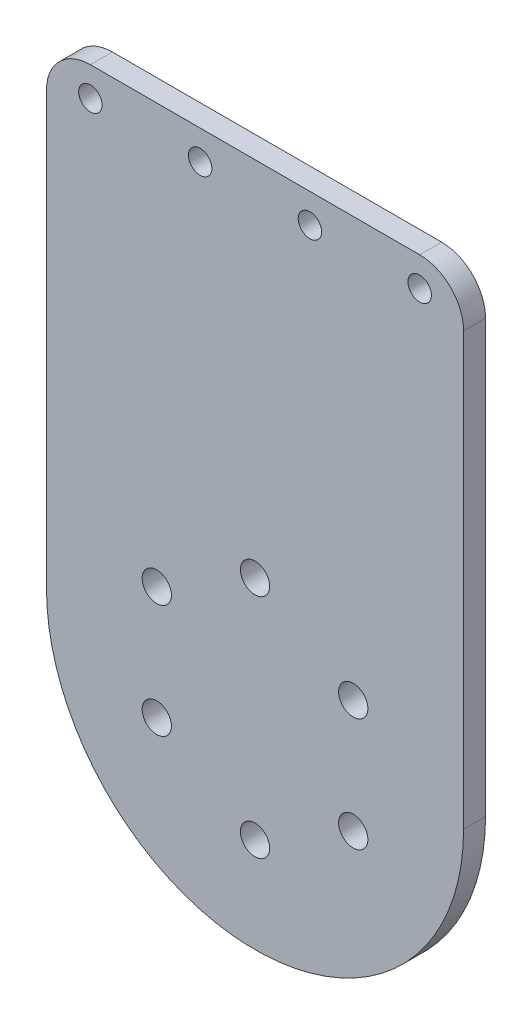
from build123d import *

# Parameters (mm, degrees)
EXTRUDE_1_DEPTH          = 3
CUT_EXTRUDE_2_REACH      = 73.037
SKETCH_4_R               = 2
SKETCH_5_OUTSIDE_W       = 80.91
SKETCH_5_OUTSIDE_H       = 117.41
SKETCH_5_OUTSIDE_R       = 1.6
CUT_EXTRUDE_3_DEPTH      = 72.03696221
FILLET_1_R               = 6
FILLET_2_R               = 6
PATTERN_CIRCULAR_1_COUNT = 6


with BuildPart() as part:
    # 草圖1 → 填料-伸長1 (new body)
    with BuildSketch(Plane.XY):
        with BuildLine():
            Line((28.5, 65), (-28.5, 65))
            Line((-28.5, 65), (-28.5, 55))
            Line((-28.5, 55), (-28.5, 0))
            ThreePointArc((-28.5, 0), (-26.682182849, -10.015543839), (-21.46062327, -18.753443653))
            ThreePointArc((-21.46062327, -18.753443653), (0, -28.5), (21.46062327, -18.753443653))
            ThreePointArc((21.46062327, -18.753443653), (26.682182849, -10.015543839), (28.5, 0))
            Line((28.5, 0), (28.5, 55.020450743))
            Line((28.5, 55.020450743), (28.5, 65))
        make_face()
    extrude(amount=EXTRUDE_1_DEPTH)

    # 草圖4 → 除料-伸長2 (cut, up to next)
    with BuildSketch(Plane.XY.offset(3), mode=Mode.PRIVATE) as cut_extrude_2_sk1:
        with Locations((0, -15.5)):
            Circle(SKETCH_4_R)
    cut_extrude_2_tool1 = extrude(cut_extrude_2_sk1.sketch, amount=-CUT_EXTRUDE_2_REACH, mode=Mode.PRIVATE) & part.part
    cut_extrude_2 = cut_extrude_2_tool1.solids().sort_by_distance((0, -15.5, 3))[0]
    add(cut_extrude_2, mode=Mode.SUBTRACT)

    # 草圖5 outside → 除料-伸長3 (cut, through all)
    # profile 1 of 5: a face of its own
    with BuildSketch(Plane.XY.offset(3)):
        with Locations((0, 18.25)):
            Rectangle(SKETCH_5_OUTSIDE_W, SKETCH_5_OUTSIDE_H)
        with BuildLine():
            Line((28.5, 65), (-28.5, 65))
            Line((-28.5, 65), (-28.5, 0))
            ThreePointArc((-28.5, 0), (0, -28.5), (28.5, 0))
            Line((28.5, 0), (28.5, 65))
        make_face(mode=Mode.SUBTRACT)
    # profile 2 of 5: a face of its own
    with BuildSketch(Plane.XY.offset(3)):
        with Locations((22.5, 61)):
            Circle(SKETCH_5_OUTSIDE_R)
    # profile 3 of 5: a face of its own
    with BuildSketch(Plane.XY.offset(3)):
        with Locations((7.5, 61)):
            Circle(SKETCH_5_OUTSIDE_R)
    # profile 4 of 5: a face of its own
    with BuildSketch(Plane.XY.offset(3)):
        with Locations((-7.5, 61)):
            Circle(SKETCH_5_OUTSIDE_R)
    # profile 5 of 5: a face of its own
    with BuildSketch(Plane.XY.offset(3)):
        with Locations((-22.5, 61)):
            Circle(SKETCH_5_OUTSIDE_R)
    extrude(amount=-CUT_EXTRUDE_3_DEPTH, mode=Mode.SUBTRACT)

    # 圓角1
    fillet_1_edges = [part.edges().sort_by_distance(p)[0] for p in [
        (-28.5, 65, 1.5),
    ]]
    fillet(fillet_1_edges, radius=FILLET_1_R)

    # 圓角2
    fillet_2_edges = [part.edges().sort_by_distance(p)[0] for p in [
        (28.5, 65, 1.5),
    ]]
    fillet(fillet_2_edges, radius=FILLET_2_R)

    # 環狀複製排列1: 除料-伸長2 ×6 about axis
    pattern_circular_1_axis = Axis((0, 0, 0), (0, 0, 1))
    for i in range(1, PATTERN_CIRCULAR_1_COUNT):
        add(cut_extrude_2.rotate(pattern_circular_1_axis, i * 360 / PATTERN_CIRCULAR_1_COUNT), mode=Mode.SUBTRACT)


solid = part.part
